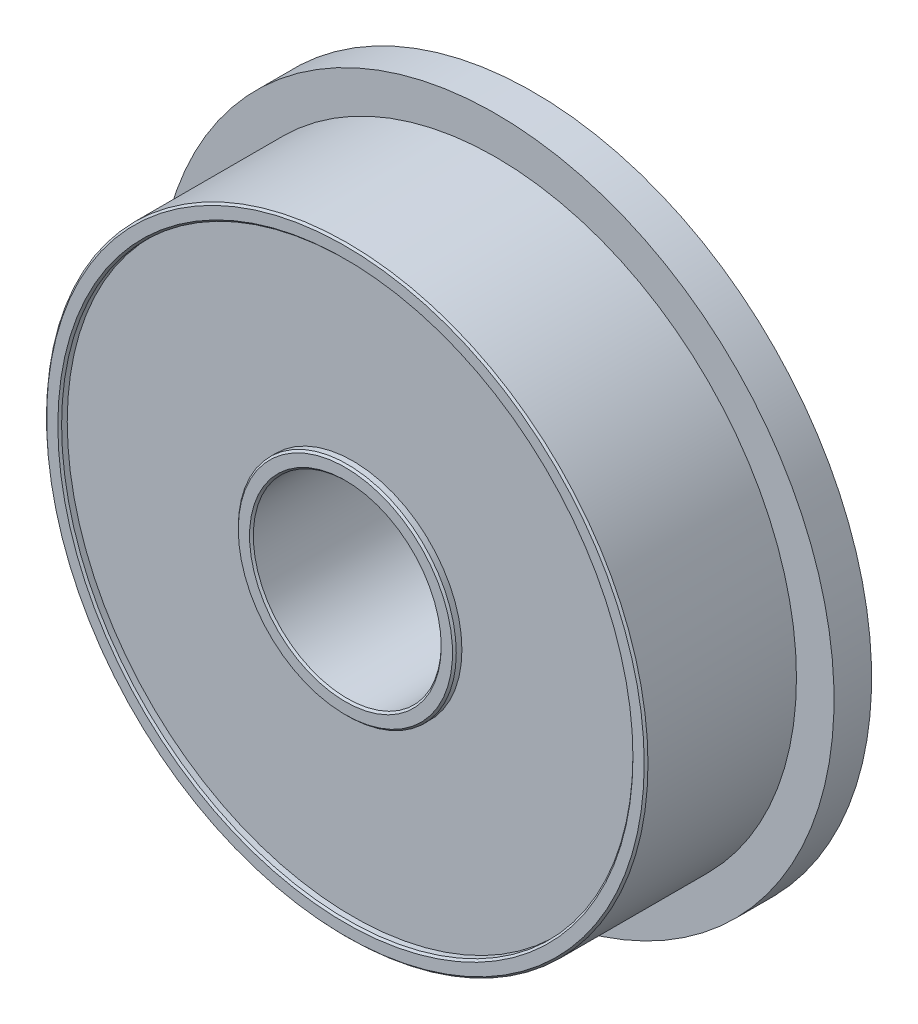
from build123d import *

# Parameters (mm, degrees)
SKETCH_1_R          = 8
SKETCH_1_R_2        = 2.5
EXTRUDE_1_DEPTH     = 2.5
SKETCH_3_R          = 9
SKETCH_3_R_2        = 2.5
EXTRUDE_2_DEPTH     = 1
SKETCH_4_R          = 7.6
SKETCH_4_R_2        = 2.9
CUT_EXTRUDE_1_DEPTH = 0.2
CHAMFER_1_SIZE      = 0.05


with BuildPart() as part:
    # 草图1 → 凸台-拉伸1 (new, symmetric)
    with BuildSketch(Plane.XY):
        Circle(SKETCH_1_R)
        Circle(SKETCH_1_R_2, mode=Mode.SUBTRACT)
    extrude(amount=EXTRUDE_1_DEPTH, both=True)

    # 草图3 → 凸台-拉伸2 (add)
    with BuildSketch(Plane(origin=(0, 0, -2.5), x_dir=(-1, 0, 0), z_dir=(0, 0, -1))):
        Circle(SKETCH_3_R)
        with Locations(Location((0, 0, 0), (0, 0, 180))):
            Circle(SKETCH_3_R_2, mode=Mode.SUBTRACT)
    extrude(amount=-EXTRUDE_2_DEPTH)

    # 草图4 → 切除-拉伸1 (cut)
    with BuildSketch(Plane.XY.offset(2.5)):
        Circle(SKETCH_4_R)
        Circle(SKETCH_4_R_2, mode=Mode.SUBTRACT)
    cut_extrude_1 = extrude(amount=-CUT_EXTRUDE_1_DEPTH, mode=Mode.SUBTRACT)

    # 镜向1: 切除-拉伸1 across plane
    add(cut_extrude_1.mirror(Plane.XY), mode=Mode.SUBTRACT)

    # 倒角1
    chamfer_1_edges = [part.edges().sort_by_distance(p)[0] for p in [
        (-7.6, 0, 2.5),
        (-2.9, 0, 2.5),
        (-2.9, 0, -2.5),
        (-7.6, 0, -2.5),
        (-8, 0, 2.5),
        (-2.5, 0, -2.5),
        (-2.5, 0, 2.5),
    ]]
    chamfer(chamfer_1_edges, length=CHAMFER_1_SIZE)


solid = part.part
